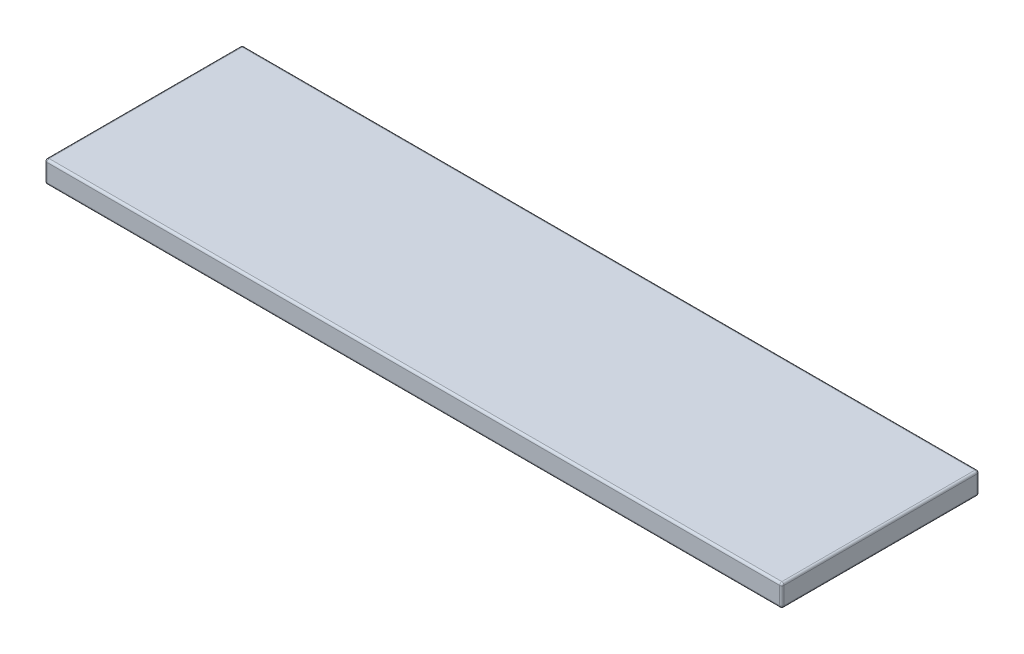
from build123d import *

# Parameters (mm, degrees)
ESBO_O1_W                = 168
ESBO_O1_H                = 45
RESSALTO_EXTRUS_O1_DEPTH = 5
FILETE1_R                = 0.5


with BuildPart() as part:
    # Esboço1 → Ressalto-extrusão1 (new body)
    with BuildSketch(Plane(origin=(0, 0, 0), x_dir=(1, 0, 0), z_dir=(0, 1, 0))):
        Rectangle(ESBO_O1_W, ESBO_O1_H)
    extrude(amount=RESSALTO_EXTRUS_O1_DEPTH)

    # Filete1
    filete1_edges = [part.edges().sort_by_distance(p)[0] for p in [
        (-84, 5, 0),
        (0, 5, 22.5),
        (84, 5, 0),
        (0, 0, 22.5),
        (-84, 0, 0),
        (0, 0, -22.5),
        (84, 0, 0),
        (0, 5, -22.5),
        (84, 2.5, 22.5),
        (-84, 2.5, 22.5),
        (-84, 2.5, -22.5),
        (84, 2.5, -22.5),
    ]]
    fillet(filete1_edges, radius=FILETE1_R)


solid = part.part
